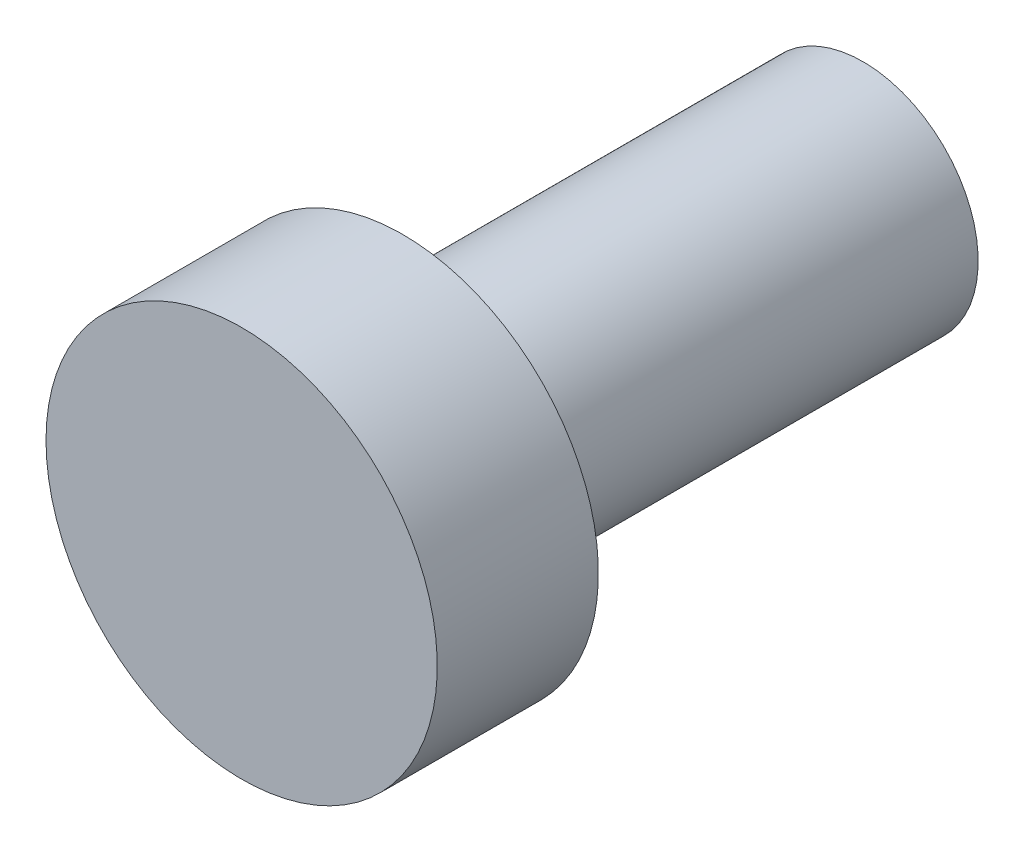
from build123d import *


with BuildPart() as part:
    # Sketch1 → REV_DIN7984_M5x10_8.8 (revolve)
    with BuildSketch(Plane(origin=(0, 0, 0), x_dir=(1, 0, 0), z_dir=(0, 1, 0)), mode=Mode.PRIVATE) as rev_din7984_m5x10_8_8_sk:
        Polygon((0, -3.5), (4.25, -3.5), (4.25, 0), (2.5, 0), (2.5, 10), (0, 10), align=None)
    revolve(rev_din7984_m5x10_8_8_sk.sketch.rotate(Axis((0, 0, -10), (0, 0, 1)), 180), axis=Axis((0, 0, -10), (0, 0, 1)))


solid = part.part
